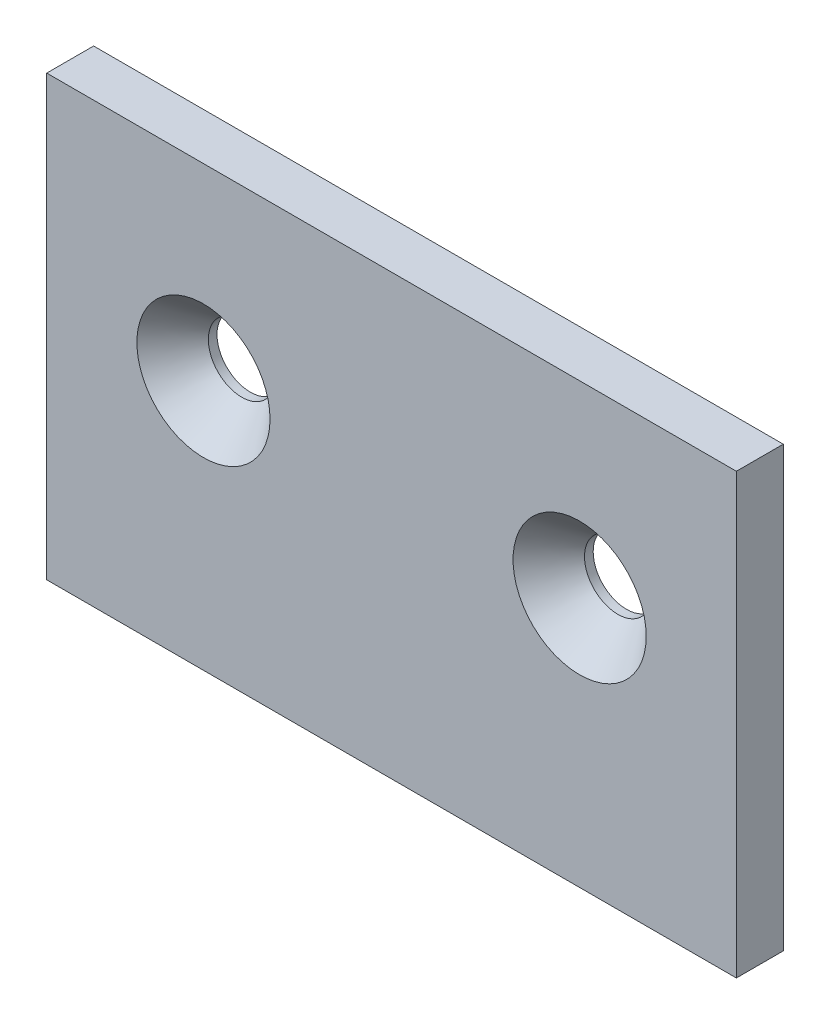
from build123d import *

# Parameters (mm, degrees)
SKETCH1_W                                    = 69.85
SKETCH1_H                                    = 44.45
BOSS_EXTRUDE1_DEPTH                          = 4.7498
CSK_FOR_1_4_FLAT_HEAD_SOCKET_CAP_SCR_2_COUNT = 2
CSK_FOR_1_4_FLAT_HEAD_SOCKET_CAP_SCR_2_PITCH = 38.1


with BuildPart() as part:
    # Sketch1 → Boss-Extrude1 (new body)
    with BuildSketch(Plane.XY):
        Rectangle(SKETCH1_W, SKETCH1_H)
    extrude(amount=BOSS_EXTRUDE1_DEPTH)

    # Sketch3 → CSK for 1/4 Flat Head Socket Cap Screw1 (revolve, cut)
    with BuildSketch(Plane(origin=(-19.05, 3.175, 4.7498), x_dir=(0, -1, 0), z_dir=(1, 0, 0))):
        Polygon((0, 0), (0, 4.7498), (3.3782, 4.7498), (3.3782, 3.871564875), (6.7437, 0), align=None)
    csk_for_1_4_flat_head_socket_cap_screw1 = revolve(axis=Axis((-19.05, 3.175, 11.0998), (0, 0, -1)), mode=Mode.SUBTRACT)

    # CSK for 1_4 Flat Head Socket Cap Scr 2: CSK for 1/4 Flat Head Socket Cap Screw1 ×2
    with Locations(*[(i * CSK_FOR_1_4_FLAT_HEAD_SOCKET_CAP_SCR_2_PITCH, 0, 0) for i in range(1, CSK_FOR_1_4_FLAT_HEAD_SOCKET_CAP_SCR_2_COUNT)]):
        add(csk_for_1_4_flat_head_socket_cap_screw1, mode=Mode.SUBTRACT)


solid = part.part
